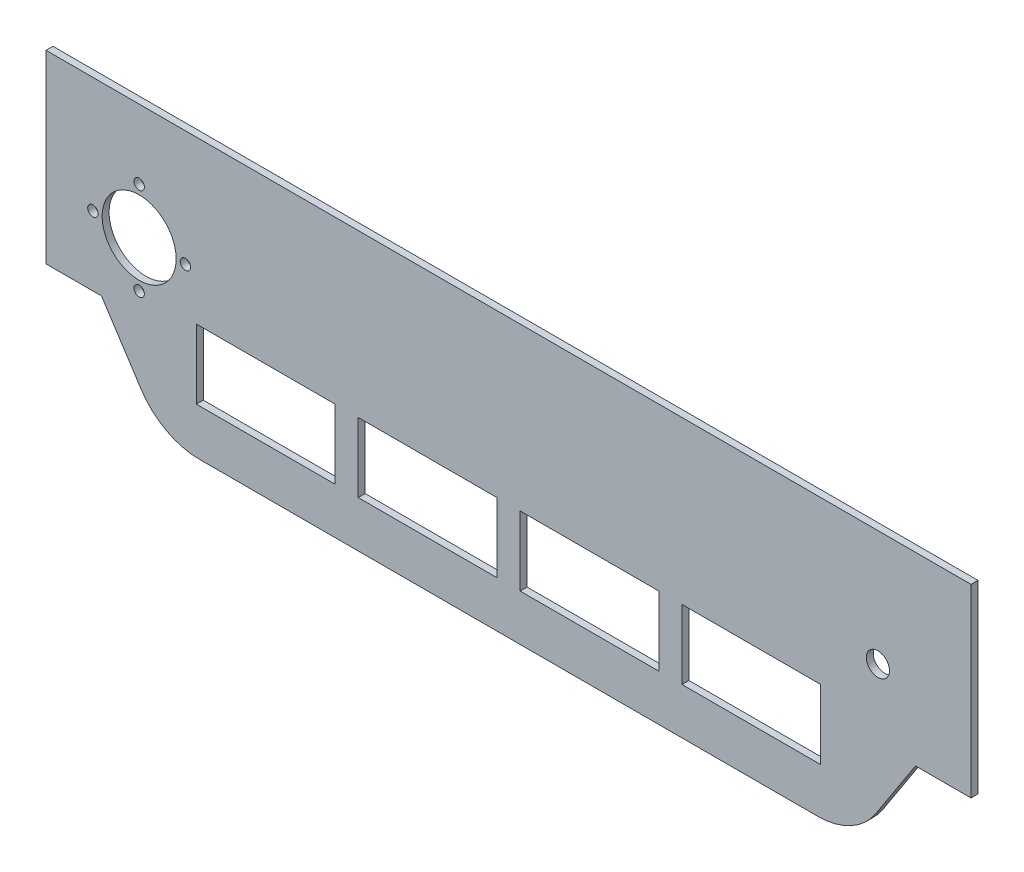
from build123d import *

# Parameters (mm, degrees)
EXTRUDE_1_DEPTH     = 3
SKETCH_2_W          = 60
SKETCH_2_H          = 30
CUT_EXTRUDE_2_DEPTH = 417.901436616
SKETCH_3_R          = 16
SKETCH_3_R_2        = 2.25
SKETCH_3_R_3        = 5
CUT_EXTRUDE_3_DEPTH = 417.901436616
EXTRUDE_START       = -3
EXTRUDE_4_DEPTH     = 3


with BuildPart() as part:
    # 草圖1 → 伸長1 (new body)
    with BuildSketch(Plane.XY):
        with BuildLine():
            Line((55.280581326, 100), (374.719418674, 100))
            ThreePointArc((374.719418674, 100), (401.086913014, 84.309271198), (399.872727163, 53.650349482))
            Line((399.872727163, 53.650349482), (373.872727163, 13.650349482))
            ThreePointArc((373.872727163, 13.650349482), (363.028689873, 3.63250566), (348.719418674, 0))
            Line((348.719418674, 0), (81.280581326, 0))
            ThreePointArc((81.280581326, 0), (66.971310127, 3.63250566), (56.127272837, 13.650349482))
            Line((56.127272837, 13.650349482), (30.127272837, 53.650349482))
            ThreePointArc((30.127272837, 53.650349482), (28.913086986, 84.309271198), (55.280581326, 100))
        make_face()
    extrude(amount=EXTRUDE_1_DEPTH)

    # 草圖2 → 伸長2 (cut, through all)
    with BuildSketch(Plane.XY.offset(3)):
        with Locations((110, 35)):
            Rectangle(SKETCH_2_W, SKETCH_2_H)
        with Locations((180, 35)):
            Rectangle(SKETCH_2_W, SKETCH_2_H)
        with Locations((250, 35)):
            Rectangle(SKETCH_2_W, SKETCH_2_H)
        with Locations((320, 35)):
            Rectangle(SKETCH_2_W, SKETCH_2_H)
    extrude(amount=-CUT_EXTRUDE_2_DEPTH, mode=Mode.SUBTRACT)

    # 草圖3 → 伸長3 (cut, through all)
    with BuildSketch(Plane.XY.offset(3)):
        with Locations((55.280581326, 70)):
            Circle(SKETCH_3_R)
        with Locations((55.280581326, 90)):
            Circle(SKETCH_3_R_2)
        with Locations((75.280581326, 70)):
            Circle(SKETCH_3_R_2)
        with Locations((55.280581326, 50)):
            Circle(SKETCH_3_R_2)
        with Locations((35.280581326, 70)):
            Circle(SKETCH_3_R_2)
        with Locations((374.719418674, 70)):
            Circle(SKETCH_3_R_3)
    extrude(amount=-CUT_EXTRUDE_3_DEPTH, mode=Mode.SUBTRACT)

    # 草圖4 → 伸長4 (add)
    with BuildSketch(Plane.XY.offset(3).offset(EXTRUDE_START)):
        with BuildLine():
            Line((399.872727163, 53.650349482), (391, 40))
            Line((391, 40), (415, 40))
            Line((415, 40), (415, 120))
            Line((415, 120), (15, 120))
            Line((15, 120), (15, 40))
            Line((15, 40), (39, 40))
            Line((39, 40), (30.127272837, 53.650349482))
            ThreePointArc((30.127272837, 53.650349482), (28.913086986, 84.309271198), (55.280581326, 100))
            Line((55.280581326, 100), (374.719418674, 100))
            ThreePointArc((374.719418674, 100), (401.086913014, 84.309271198), (399.872727163, 53.650349482))
        make_face()
    extrude(amount=EXTRUDE_4_DEPTH)


solid = part.part
